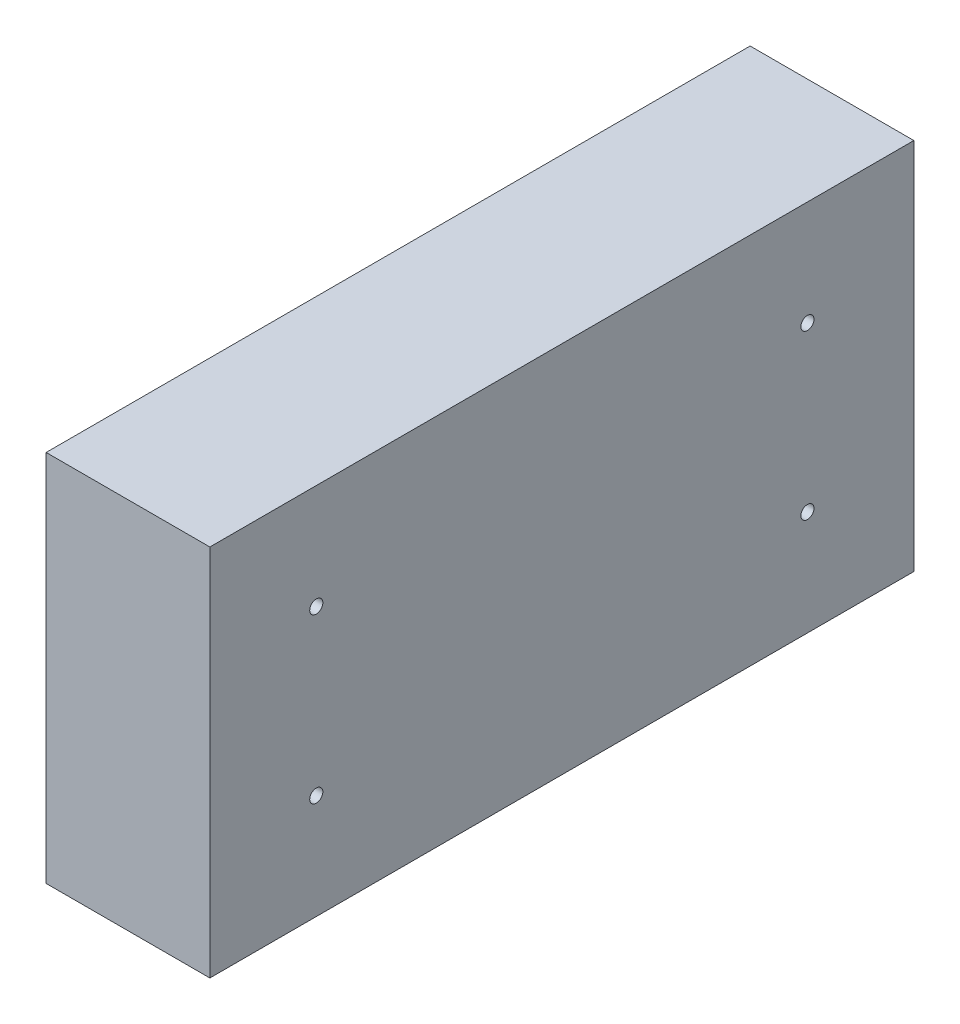
from build123d import *

# Parameters (mm, degrees)
SKETCH_1_W          = 215
SKETCH_1_H          = 114
EXTRUDE_1_DEPTH     = 50
SKETCH_2_W          = 22.304316617
SKETCH_2_H          = 103.168471384
CUT_EXTRUDE_1_DEPTH = 40
SKETCH_3_R          = 2
CUT_EXTRUDE_2_DEPTH = 4


with BuildPart() as part:
    # 草图1 → 凸台-拉伸1 (new body)
    with BuildSketch(Plane(origin=(0, 0, 0), x_dir=(0, 0, -1), z_dir=(1, 0, 0))):
        with Locations((-107.5, 57)):
            Rectangle(SKETCH_1_W, SKETCH_1_H)
    extrude(amount=EXTRUDE_1_DEPTH)

    # 草图2 → 切除-拉伸1 (cut)
    with BuildSketch(Plane.ZY):
        with Locations((11.152158309, 57.116706416)):
            Rectangle(SKETCH_2_W, SKETCH_2_H)
    extrude(amount=-CUT_EXTRUDE_1_DEPTH, mode=Mode.SUBTRACT)

    # 草图3 → 切除-拉伸2 (cut)
    with BuildSketch(Plane(origin=(50, 0, 0), x_dir=(0, 0, -1), z_dir=(1, 0, 0))):
        with Locations((-182.5, 82)):
            Circle(SKETCH_3_R)
        with Locations((-32.5, 82)):
            Circle(SKETCH_3_R)
        with Locations((-32.5, 32)):
            Circle(SKETCH_3_R)
        with Locations((-182.5, 32)):
            Circle(SKETCH_3_R)
    extrude(amount=-CUT_EXTRUDE_2_DEPTH, mode=Mode.SUBTRACT)


solid = part.part
